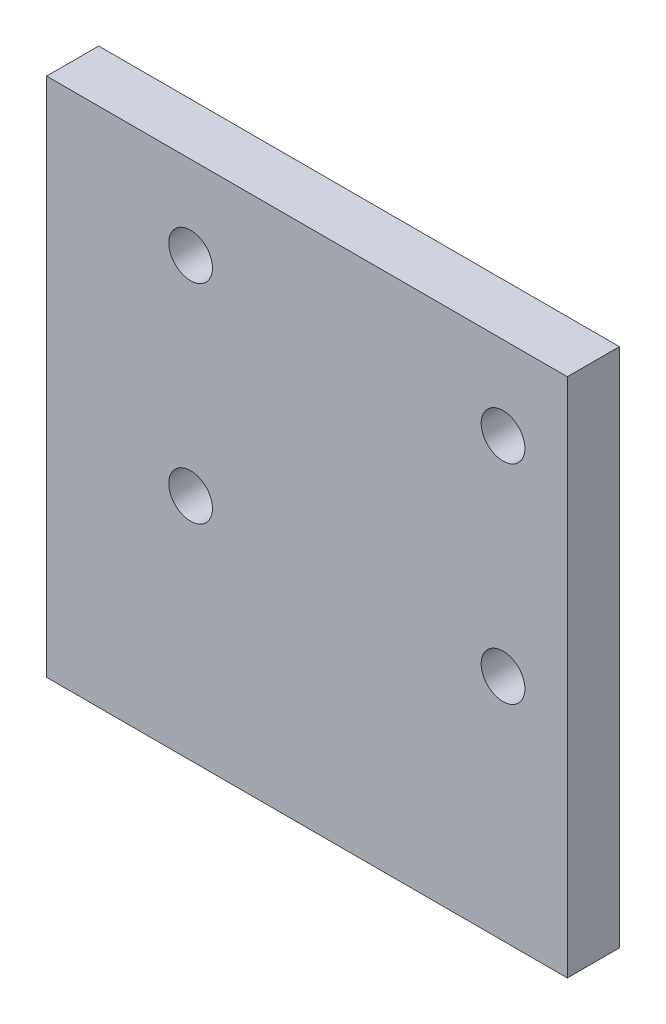
from build123d import *

# Parameters (mm, degrees)
SKETCH_1_W          = 50
SKETCH_1_H          = 50
EXTRUDE_1_DEPTH     = 5
SKETCH_2_R          = 2.1
CUT_EXTRUDE_1_DEPTH = 5


with BuildPart() as part:
    # 스케치1 → 보스-돌출1 (new body)
    with BuildSketch(Plane.XY):
        Rectangle(SKETCH_1_W, SKETCH_1_H)
    extrude(amount=EXTRUDE_1_DEPTH)

    # 스케치2 → 컷-돌출1 (cut)
    with BuildSketch(Plane.XY.offset(5)):
        with Locations((-11.173531489, -3)):
            Circle(SKETCH_2_R)
        with Locations((18.826468511, -3)):
            Circle(SKETCH_2_R)
        with Locations((-11.173531489, 17)):
            Circle(SKETCH_2_R)
        with Locations((18.826468511, 17)):
            Circle(SKETCH_2_R)
    extrude(amount=-CUT_EXTRUDE_1_DEPTH, mode=Mode.SUBTRACT)


solid = part.part
